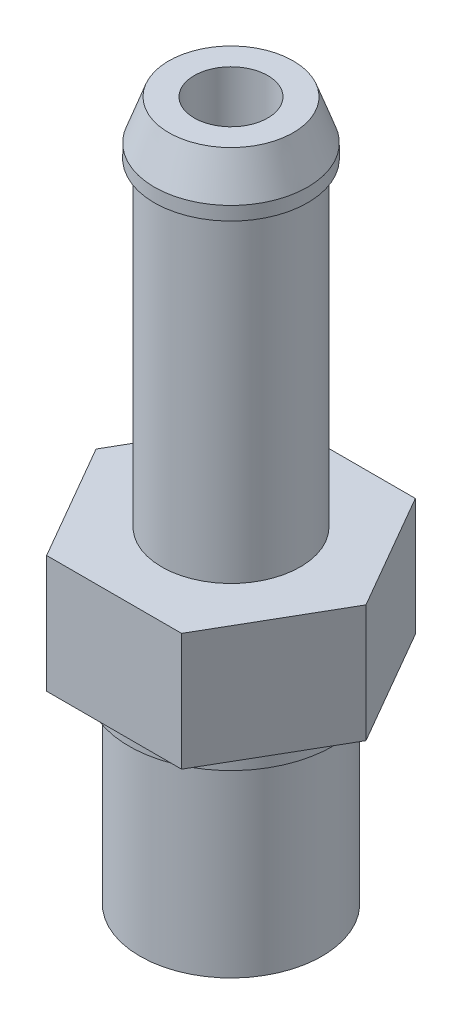
from build123d import *

# Parameters (mm, degrees)
BOSS_EXTRUDE1_DEPTH = 8.0391
SKETCH3_R           = 4.7371
BOSS_EXTRUDE2_DEPTH = 21.8059
SKETCH4_R           = 5.23875
BOSS_EXTRUDE3_DEPTH = 0.9271
SKETCH11_R          = 6.96595
BOSS_EXTRUDE4_DEPTH = 1.4605
SKETCH12_R          = 6.223
BOSS_EXTRUDE5_DEPTH = 12.8016
SKETCH24_R          = 2.5146
CUT_EXTRUDE1_DEPTH  = 50.298716199
SKETCH25_R          = 3.62585
CUT_EXTRUDE2_DEPTH  = 16.4592


with BuildPart() as part:
    # Sketch1 → Boss-Extrude1 (new body)
    with BuildSketch(Plane(origin=(0, 0, 0), x_dir=(1, 0, 0), z_dir=(0, 1, 0))):
        Polygon((9.224094311, 0), (4.612047155, 7.9883), (-4.612047155, 7.9883), (-9.224094311, 0), (-4.612047155, -7.9883), (4.612047155, -7.9883), align=None)
    extrude(amount=BOSS_EXTRUDE1_DEPTH)

    # Sketch3 → Boss-Extrude2 (add)
    with BuildSketch(Plane(origin=(0, 8.0391, 0), x_dir=(1, 0, 0), z_dir=(0, 1, 0))):
        with Locations(Location((0, 0, 0), (0, 0, 270))):
            Circle(SKETCH3_R)
    extrude(amount=BOSS_EXTRUDE2_DEPTH)

    # Sketch4 → Boss-Extrude3 (add)
    with BuildSketch(Plane(origin=(0, 29.845, 0), x_dir=(1, 0, 0), z_dir=(0, 1, 0))):
        with Locations(Location((0, 0, 0), (0, 0, 270))):
            Circle(SKETCH4_R)
    extrude(amount=BOSS_EXTRUDE3_DEPTH)

    # Sketch10 → Revolve1 (revolve)
    with BuildSketch(Plane(origin=(0, 0, 0), x_dir=(0, 0, -1), z_dir=(1, 0, 0)), mode=Mode.PRIVATE) as revolve1_sk:
        Polygon((0, 30.7721), (0, 33.5026), (-2.49555, 33.5026), (-4.2545, 33.5026), (-5.23875, 30.7721), align=None)
    revolve(revolve1_sk.sketch.rotate(Axis((0, 30.7721, 0), (0, 1, 0)), 180), axis=Axis((0, 30.7721, 0), (0, 1, 0)))

    # Sketch11 → Boss-Extrude4 (add)
    with BuildSketch(Plane(origin=(0, 0, 0), x_dir=(-1, 0, 0), z_dir=(0, -1, 0))):
        with Locations(Location((0, 0, 0), (0, 0, 90))):
            Circle(SKETCH11_R)
    extrude(amount=BOSS_EXTRUDE4_DEPTH)

    # Sketch12 → Boss-Extrude5 (add)
    with BuildSketch(Plane(origin=(0, -1.4605, 0), x_dir=(-1, 0, 0), z_dir=(0, -1, 0))):
        with Locations(Location((0, 0, 0), (0, 0, 90))):
            Circle(SKETCH12_R)
    extrude(amount=BOSS_EXTRUDE5_DEPTH)

    # Sketch24 → Cut-Extrude1 (cut, through all)
    with BuildSketch(Plane(origin=(0, 33.5026, 0), x_dir=(1, 0, 0), z_dir=(0, 1, 0))):
        with Locations(Location((0, 0, 0), (0, 0, 270))):
            Circle(SKETCH24_R)
    extrude(amount=-CUT_EXTRUDE1_DEPTH, mode=Mode.SUBTRACT)

    # Sketch25 → Cut-Extrude2 (cut)
    with BuildSketch(Plane(origin=(0, -14.2621, 0), x_dir=(-1, 0, 0), z_dir=(0, -1, 0))):
        with Locations(Location((0, 0, 0), (0, 0, 90))):
            Circle(SKETCH25_R)
    extrude(amount=-CUT_EXTRUDE2_DEPTH, mode=Mode.SUBTRACT)


solid = part.part
